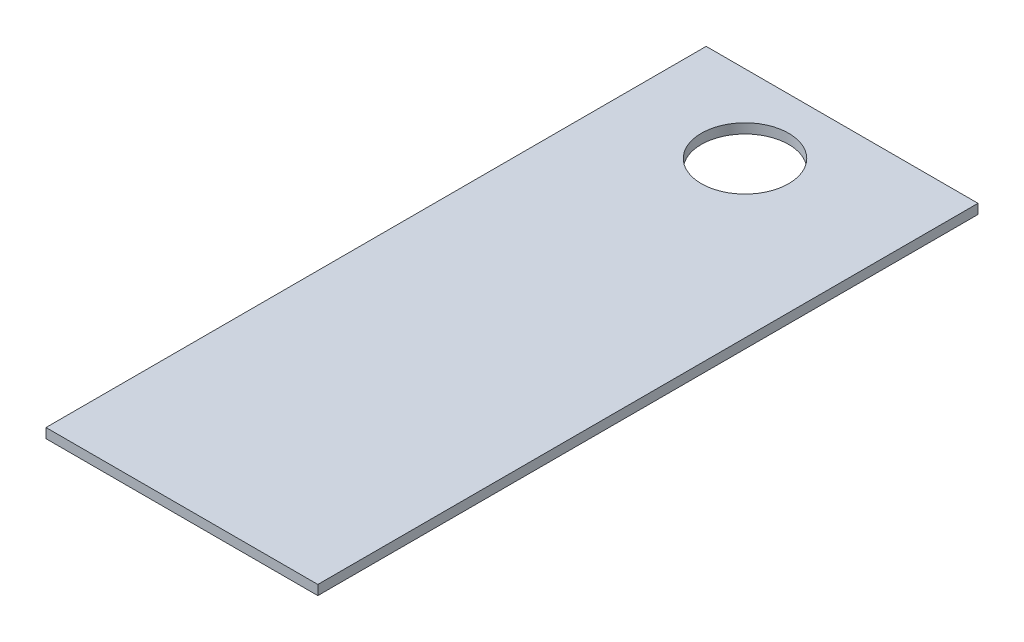
from build123d import *

# Parameters (mm, degrees)
SKETCH1_R           = 14.2875
BOSS_EXTRUDE1_DEPTH = 3.175


with BuildPart() as part:
    # Sketch1 → Boss-Extrude1 (new body)
    with BuildSketch(Plane(origin=(0, 0, 0), x_dir=(1, 0, 0), z_dir=(0, 1, 0))):
        Polygon((-44.45, -107.95), (44.45, -107.95), (44.45, -31.75), (44.45, 107.95), (-44.45, 107.95), align=None)
        with Locations(Location((-6.35, 82.55, 0), (0, 0, 270))):
            Circle(SKETCH1_R, mode=Mode.SUBTRACT)
    extrude(amount=BOSS_EXTRUDE1_DEPTH)


solid = part.part
